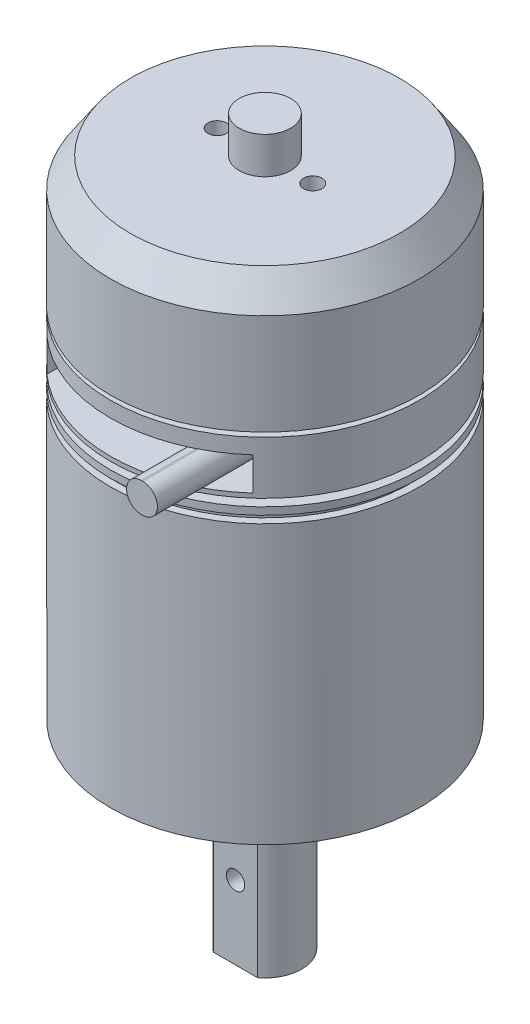
from build123d import *

# Parameters (mm, degrees)
SKETCH_2_W             = 28
SKETCH_2_H             = 4.5
CUT_EXTRUDE_1_DEPTH    = 10
EXTRUDE_1_DEPTH        = 15
HOLE_WIZARD_M3_1_D     = 2.5
HOLE_WIZARD_M3_1_DEPTH = 4
HOLE_WIZARD_M3_1_TIP   = 0.751075774
CUT_EXTRUDE_START      = -20
CUT_EXTRUDE_2_DEPTH    = 20
HOLE_WIZARD_M4_1_D     = 3.3
HOLE_WIZARD_M4_1_DEPTH = 10.1
HOLE_WIZARD_M4_1_TIP   = 0.991420021
HOLE_WIZARD_M3_2_D     = 2.5
HOLE_WIZARD_M5_1_D     = 4.2
HOLE_WIZARD_M5_1_DEPTH = 14
HOLE_WIZARD_M5_1_TIP   = 1.2618073


with BuildPart() as part:
    # 草图1 → 旋转1 (revolve)
    with BuildSketch(Plane.XY, mode=Mode.PRIVATE) as revolve_1_sk:
        Polygon((0, 0), (4.1, 0), (4.1, 6.7), (13.4, 6.7), (13.4, 8.7), (21, 8.7), (21, 10.2), (20, 10.2), (20, 11.2), (21, 11.2), (21, 12.2), (10, 12.2), (10, 13.2), (21, 13.2), (21, 20.4), (5, 20.4), (5, 21), (21, 21), (21, 34.7), (18.3, 38.7), (3.5, 38.7), (3.5, 43.7), (0, 43.7), align=None)
    revolve(revolve_1_sk.sketch.rotate(Axis((0, 43.7, 0), (0, -1, 0)), 90), axis=Axis((0, 43.7, 0), (0, -1, 0)))

    # 草图2 → 切除-拉伸1 (cut)
    with BuildSketch(Plane.XY.offset(21)):
        with Locations((0, 16.05)):
            Rectangle(SKETCH_2_W, SKETCH_2_H)
    extrude(amount=-CUT_EXTRUDE_1_DEPTH, mode=Mode.SUBTRACT)

    # 草图3 → 凸台-拉伸1 (add)
    with BuildSketch(Plane.XY.offset(11)):
        with BuildLine():
            Line((9.185056323, 18.053194417), (9.385056323, 18.053194417))
            ThreePointArc((9.385056323, 18.053194417), (11.385056323, 16.053194417), (9.385056323, 14.053194417))
            Line((9.385056323, 14.053194417), (9.185056323, 14.053194417))
            ThreePointArc((9.185056323, 14.053194417), (7.185056323, 16.053194417), (9.185056323, 18.053194417))
        make_face()
    extrude(amount=EXTRUDE_1_DEPTH)

    # M3 螺纹孔1
    with Locations(Plane(origin=(0, 38.7, 0), x_dir=(1, 0, 0), z_dir=(0, 1, 0))):
        with Locations((-6.5, 0), (6.5, 0)):
            Hole(HOLE_WIZARD_M3_1_D / 2, depth=HOLE_WIZARD_M3_1_DEPTH)
            with Locations((0, 0, -(HOLE_WIZARD_M3_1_DEPTH + HOLE_WIZARD_M3_1_TIP / 2))):  # 118° drill point
                Cone(0, HOLE_WIZARD_M3_1_D / 2, HOLE_WIZARD_M3_1_TIP, mode=Mode.SUBTRACT)

    # 草图7 → 旋转2 (revolve)
    with BuildSketch(Plane.XY, mode=Mode.PRIVATE) as revolve_2_sk:
        Polygon((0, -54.6), (5, -54.6), (5, -30.5), (8.275, -30.5), (8.275, -29.6), (13, -29.6), (13, -27.6), (21, -27.6), (21, 8.7), (0, 8.7), align=None)
    revolve(revolve_2_sk.sketch.rotate(Axis((0, 8.7, 0), (0, -1, 0)), 180), axis=Axis((0, 8.7, 0), (0, -1, 0)))

    # 草图8 → 切除-拉伸2 (cut)
    with BuildSketch(Plane.XZ.offset(54.6).offset(CUT_EXTRUDE_START)):
        with BuildLine():
            Line((-3, 4), (3, 4))
            ThreePointArc((3, 4), (0, 5), (-3, 4))
        make_face()
    extrude(amount=CUT_EXTRUDE_2_DEPTH, mode=Mode.SUBTRACT)

    # M4 螺纹孔1
    with Locations(Plane(origin=(0, -27.6, 0), x_dir=(-1, 0, 0), z_dir=(0, -1, 0))):
        with Locations((0, -17.5), (-17.5, 0), (0, 17.5), (17.5, 0)):
            Hole(HOLE_WIZARD_M4_1_D / 2, depth=HOLE_WIZARD_M4_1_DEPTH)
            with Locations((0, 0, -(HOLE_WIZARD_M4_1_DEPTH + HOLE_WIZARD_M4_1_TIP / 2))):  # 118° drill point
                Cone(0, HOLE_WIZARD_M4_1_D / 2, HOLE_WIZARD_M4_1_TIP, mode=Mode.SUBTRACT)

    # M3 螺纹孔2 (through all)
    with Locations(Plane(origin=(0, -44.6, 4), x_dir=(1, 0, 0), z_dir=(0, 0, 1))):
        with Locations((0, 0)):
            Hole(HOLE_WIZARD_M3_2_D / 2)

    # M5 螺纹孔1
    with Locations(Plane(origin=(0, -54.6, 0), x_dir=(-1, 0, 0), z_dir=(0, -1, 0))):
        with Locations((0, 0)):
            Hole(HOLE_WIZARD_M5_1_D / 2, depth=HOLE_WIZARD_M5_1_DEPTH)
            with Locations((0, 0, -(HOLE_WIZARD_M5_1_DEPTH + HOLE_WIZARD_M5_1_TIP / 2))):  # 118° drill point
                Cone(0, HOLE_WIZARD_M5_1_D / 2, HOLE_WIZARD_M5_1_TIP, mode=Mode.SUBTRACT)


solid = part.part
